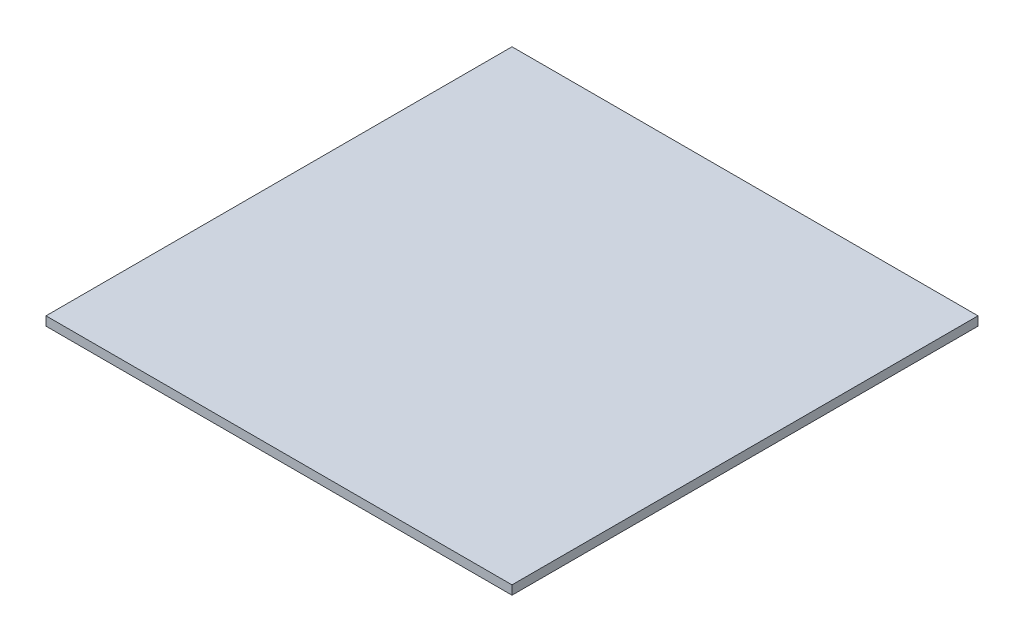
from build123d import *

# Parameters (mm, degrees)
SKETCH1_W           = 220
SKETCH1_H           = 220
BOSS_EXTRUDE1_DEPTH = 4.25


with BuildPart() as part:
    # Sketch1 → Boss-Extrude1 (new body)
    with BuildSketch(Plane(origin=(0, 0, 0), x_dir=(1, 0, 0), z_dir=(0, 1, 0))):
        with Locations((110, 110)):
            Rectangle(SKETCH1_W, SKETCH1_H)
    extrude(amount=BOSS_EXTRUDE1_DEPTH)


solid = part.part
